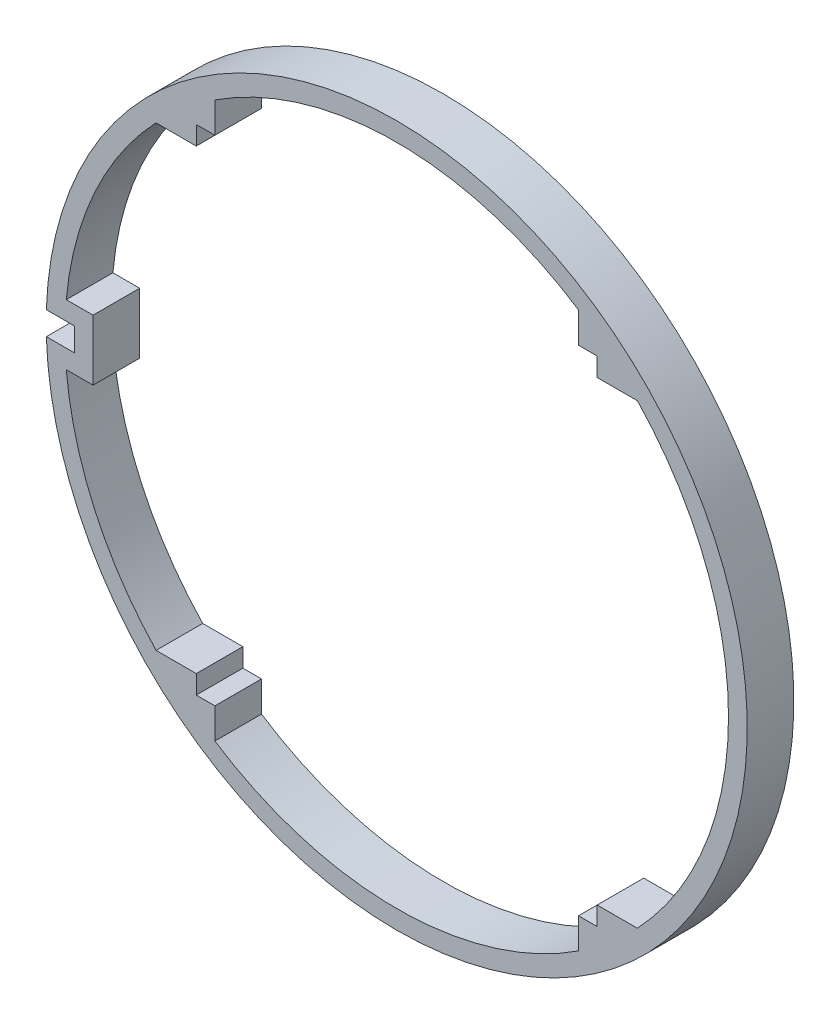
from build123d import *

# Parameters (mm, degrees)
BOSS_EXTRUDE1_DEPTH = 10
BOSS_EXTRUDE2_DEPTH = 10


with BuildPart() as part:
    # Sketch1 → Boss-Extrude1 (new body)
    with BuildSketch(Plane(origin=(0, 0, 0), x_dir=(0, 1, 0), z_dir=(0, 0, 1))):
        with BuildLine():
            Line((-2.500306968, 75.158422449), (-2.500306968, 71.139205273))
            Line((-2.500306968, 71.139205273), (-2.500306968, 69.139205273))
            Line((-2.500306968, 69.139205273), (2.500252848, 69.139205273))
            Line((2.500252848, 69.139205273), (2.500252848, 71.139196387))
            Line((2.500252848, 71.139196387), (2.500252848, 75.15842425))
            ThreePointArc((2.500252848, 75.15842425), (2.7075e-05, -75.2), (-2.500306968, 75.158422449))
        make_face()
        with BuildLine():
            Line((-6.501119998, 70.885625945), (-6.501119998, 65.138162172))
            Line((-6.501119998, 65.138162172), (6.502991614, 65.138162172))
            Line((6.502991614, 65.138162172), (6.502991614, 70.885454269))
            ThreePointArc((6.502991614, 70.885454269), (-0.000939736, -71.18311967), (-6.501119998, 70.885625945))
        make_face(mode=Mode.SUBTRACT)
    extrude(amount=BOSS_EXTRUDE1_DEPTH)

    # Sketch3 → Boss-Extrude2 (add)
    with BuildSketch(Plane.XY.offset(10)):
        Polygon((42.999947541, -53.014633283), (42.999947541, -49.014633283), (55.729863476, -49.014633283), (38.999947541, -62.774922679), (38.999947541, -53.014633283), align=None)
        Polygon((42.999947541, 52.985366717), (42.999947541, 48.985366717), (54.948623561, 48.985366717), (38.999947541, 61.804425072), (38.999947541, 52.985366717), align=None)
        Polygon((-43.000052459, 52.985366717), (-39.000052459, 52.985366717), (-39.000052459, 61.804425072), (-54.585609019, 48.985366717), (-43.000052459, 48.985366717), align=None)
        Polygon((-43.000052459, -53.014633283), (-39.000052459, -53.014633283), (-39.000052459, -62.774922679), (-54.585609019, -49.014633283), (-43.000052459, -49.014633283), align=None)
    extrude(amount=-BOSS_EXTRUDE2_DEPTH)


solid = part.part
